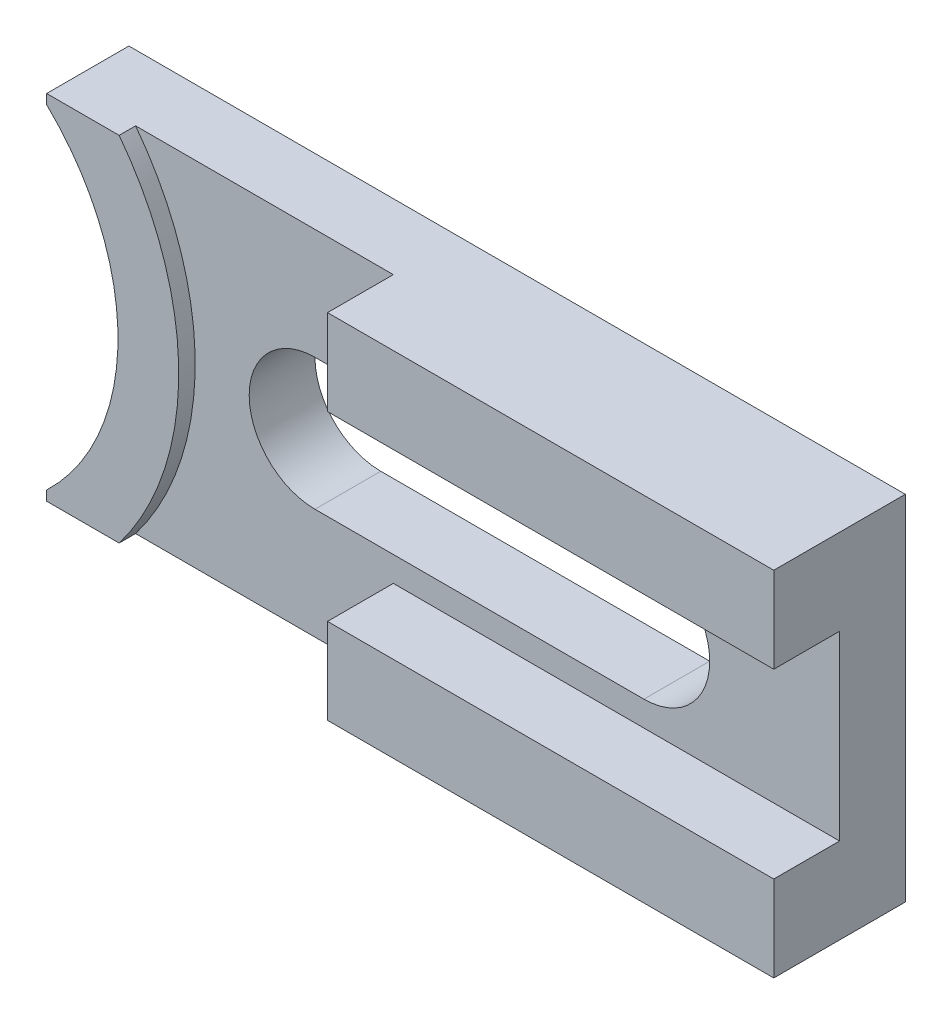
from build123d import *

# Parameters (mm, degrees)
SKETCH2_W                = 17.229179535
SKETCH2_H                = 3.310134884
BOSS_EXTRUDE1_DEPTH      = 2.54
BOSS_EXTRUDE1_2_DEPTH    = 2.54
BOSS_EXTRUDE2_DEPTH      = 2.54
BOSS_EXTRUDE3_DEPTH      = 0.635
BOSS_EXTRUDE3_DEPTH_BACK = 2.54
CUT_EXTRUDE2_DEPTH       = 38.115659497
CUT_EXTRUDE3_DEPTH       = 0.5


with BuildPart() as part:
    # Sketch2 → Boss-Extrude1 (new body)
    with BuildSketch(Plane.XY):
        with Locations((27.514228352, 5.16213735)):
            Rectangle(SKETCH2_W, SKETCH2_H)
    extrude(amount=BOSS_EXTRUDE1_DEPTH)



with BuildPart() as body_2:
    # Sketch2 → Boss-Extrude1 2 (new body)
    with BuildSketch(Plane.XY):
        with Locations((27.514228352, -5.16213735)):
            Rectangle(SKETCH2_W, SKETCH2_H)
    extrude(amount=BOSS_EXTRUDE1_2_DEPTH)


with BuildPart() as part_1:
    add(part.part)

    add(body_2.part)  # Boss-Extrude2 merges body 2
    # Sketch2<3> → Boss-Extrude2 (add)
    with BuildSketch(Plane.XY):
        with BuildLine():
            Line((36.128818119, 6.817204792), (8.949202134, 6.817204792))
            ThreePointArc((8.949202134, 6.817204792), (11.25, 0), (8.949202134, -6.817204792))
            Line((8.949202134, -6.817204792), (36.128818119, -6.817204792))
            Line((36.128818119, -6.817204792), (36.128818119, 6.817204792))
        make_face()
    extrude(amount=-BOSS_EXTRUDE2_DEPTH)

    # Sketch2<5> → Boss-Extrude3 (add, two sides: drawn at the far end of the back side and taken through both)
    with BuildSketch(Plane.XY.offset(-BOSS_EXTRUDE3_DEPTH_BACK)):
        with BuildLine():
            ThreePointArc((11.25, 0), (10.659292284, 3.597497463), (8.949202134, 6.817204792))
            Line((8.949202134, 6.817204792), (6.15087204, 6.817204792))
            Line((6.15087204, 6.817204792), (6.15087204, 6.439326944))
            ThreePointArc((6.15087204, 6.439326944), (8.187532429, 3.501781128), (8.904951339, 0))
            ThreePointArc((8.904951339, 0), (8.187532429, -3.501781128), (6.15087204, -6.439326944))
            Line((6.15087204, -6.439326944), (6.15087204, -6.817204792))
            Line((6.15087204, -6.817204792), (8.949202134, -6.817204792))
            ThreePointArc((8.949202134, -6.817204792), (10.659292284, -3.597497463), (11.25, 0))
        make_face()
    extrude(amount=BOSS_EXTRUDE3_DEPTH + BOSS_EXTRUDE3_DEPTH_BACK)

    # Sketch3 → Cut-Extrude2 (cut, through all)
    with BuildSketch(Plane(origin=(0, 0, -2.54), x_dir=(-1, 0, 0), z_dir=(0, 0, -1))):
        with BuildLine():
            Line((-28.575, 2.54), (-15.875, 2.54))
            ThreePointArc((-15.875, 2.54), (-13.335, 0), (-15.875, -2.54))
            Line((-15.875, -2.54), (-28.575, -2.54))
            ThreePointArc((-28.575, -2.54), (-31.115, 0), (-28.575, 2.54))
        make_face()
    extrude(amount=-CUT_EXTRUDE2_DEPTH, mode=Mode.SUBTRACT)

    # Sketch4 → Cut-Extrude3 (cut)
    # profile 1 of 5: a face of its own
    with BuildSketch(Plane(origin=(0, 0, -2.54), x_dir=(-1, 0, 0), z_dir=(0, 0, -1))):
        with BuildLine():
            Line((-33.225274444, 3.974358974), (-33.109088547, 3.756410256))
            add(Edge.make_bspline(
                [(-33.109088547, 3.756410256), (-33.135397759, 3.740527107), (-33.185681951, 3.710170009), (-33.253420727, 3.660322112), (-33.311184101, 3.610759802), (-33.358913749, 3.560993838), (-33.395842991, 3.510332935), (-33.422532526, 3.459294284), (-33.439307786, 3.407558443), (-33.441395009, 3.372578171), (-33.44242188, 3.35536859)],
                knots=[0, 0, 0, 0, 1.354943589, 2.589672558, 3.704607527, 4.708856974, 5.624398268, 6.459549776, 7.242129862, 8, 8, 8, 8], degree=3))
            add(Edge.make_bspline(
                [(-33.44242188, 3.35536859), (-33.441905488, 3.339302478), (-33.440882664, 3.307480132), (-33.432011039, 3.260724124), (-33.41849678, 3.215449059), (-33.399241833, 3.172453164), (-33.375690629, 3.132691911), (-33.347484885, 3.097656085), (-33.31601471, 3.067453928), (-33.280806652, 3.043011922), (-33.243529513, 3.023610821), (-33.204637166, 3.010092109), (-33.164605399, 3.001638382), (-33.137575532, 3.000550109), (-33.123912265, 3)],
                knots=[0, 0, 0, 0, 1.088566894, 2.156137864, 3.216115032, 4.286409646, 5.342511199, 6.341014339, 7.327494598, 8.289734136, 9.237503728, 10.168335026, 11.074115738, 12, 12, 12, 12], degree=3))
            add(Edge.make_bspline(
                [(-33.123912265, 3), (-33.108330276, 3.000736823), (-33.076808333, 3.002227397), (-33.030325685, 3.015739917), (-32.983768676, 3.035686613), (-32.954965866, 3.054921495), (-32.940018034, 3.064903846)],
                knots=[0, 0, 0, 0, 0.942144539, 1.905933023, 2.913239343, 4, 4, 4, 4], degree=3))
            add(Edge.make_bspline(
                [(-32.940018034, 3.064903846), (-32.929120466, 3.073486486), (-32.906180161, 3.091553671), (-32.871643174, 3.12213629), (-32.835615972, 3.157921969), (-32.798261088, 3.198852657), (-32.75874151, 3.244208916), (-32.718078641, 3.294761196), (-32.675585273, 3.350152128), (-32.647077398, 3.388968556), (-32.632325726, 3.409054487)],
                knots=[0, 0, 0, 0, 0.718593868, 1.512701116, 2.388487339, 3.348232282, 4.383172848, 5.504845107, 6.708858268, 8, 8, 8, 8], degree=3))
            add(Edge.make_bspline(
                [(-32.632325726, 3.409054487), (-32.617435689, 3.42953688), (-32.588865877, 3.468836855), (-32.546982401, 3.52420709), (-32.508363515, 3.573851894), (-32.472979034, 3.617390572), (-32.440521413, 3.654828072), (-32.41112384, 3.68608553), (-32.38559306, 3.712103925), (-32.368414754, 3.726085468), (-32.360691111, 3.732371795)],
                knots=[0, 0, 0, 0, 1.435833971, 2.754963323, 3.936484598, 5.002077172, 5.935979083, 6.744956812, 7.435712417, 8, 8, 8, 8], degree=3))
            add(Edge.make_bspline(
                [(-32.360691111, 3.732371795), (-32.348833292, 3.741548982), (-32.325537652, 3.759578305), (-32.288169937, 3.782404052), (-32.250313166, 3.802045096), (-32.211616809, 3.818222408), (-32.172204487, 3.83075885), (-32.131937984, 3.83938333), (-32.090977246, 3.845466888), (-32.063304366, 3.845924035), (-32.049393034, 3.846153846)],
                knots=[0, 0, 0, 0, 1.064105702, 2.090521257, 3.104283852, 4.09061442, 5.065433238, 6.036507983, 7.012940167, 8, 8, 8, 8], degree=3))
            add(Edge.make_bspline(
                [(-32.049393034, 3.846153846), (-32.027697321, 3.845432655), (-31.984741397, 3.844004748), (-31.922053473, 3.83116358), (-31.862182813, 3.810529215), (-31.805903248, 3.781653649), (-31.753779275, 3.745555142), (-31.706708212, 3.702931404), (-31.666391875, 3.652799642), (-31.632269691, 3.596970713), (-31.604624254, 3.536757845), (-31.584912972, 3.473349155), (-31.572964926, 3.407501727), (-31.571412089, 3.362763111), (-31.570627008, 3.340144231)],
                knots=[0, 0, 0, 0, 1.004646316, 1.989126202, 2.95222254, 3.932177672, 4.910861341, 5.883497635, 6.864703059, 7.88170562, 8.909314152, 9.927333358, 10.952104425, 12, 12, 12, 12], degree=3))
            add(Edge.make_bspline(
                [(-31.570627008, 3.340144231), (-31.571546277, 3.314461743), (-31.573366893, 3.263597453), (-31.585704912, 3.188618707), (-31.607918669, 3.116920605), (-31.63243853, 3.059175696), (-31.657508158, 3.014318465), (-31.680150325, 2.980392023), (-31.70577481, 2.945619171), (-31.735658977, 2.911101266), (-31.768356916, 2.875492989), (-31.805646013, 2.840617769), (-31.845389183, 2.804268538), (-31.874050949, 2.781100869), (-31.888735983, 2.769230769)],
                knots=[0, 0, 0, 0, 1.360590218, 2.69465552, 4.010645498, 5.328858611, 6.009843139, 6.729980544, 7.488405022, 8.296451933, 9.147430815, 10.048128915, 10.999946711, 12, 12, 12, 12], degree=3))
            Line((-31.888735983, 2.769230769), (-32.03216547, 2.978365385))
            add(Edge.make_bspline(
                [(-32.03216547, 2.978365385), (-32.020488735, 2.98925556), (-31.997968907, 3.010258425), (-31.966438434, 3.041513461), (-31.937940019, 3.070722889), (-31.912582309, 3.098006964), (-31.890372468, 3.123445151), (-31.872107523, 3.147719243), (-31.856228601, 3.1694388), (-31.840192493, 3.196305686), (-31.824692394, 3.229698776), (-31.810834516, 3.270728438), (-31.803164213, 3.31368597), (-31.8019919, 3.342653293), (-31.801396239, 3.357371795)],
                knots=[0, 0, 0, 0, 1.253529984, 2.417566204, 3.48529857, 4.457251953, 5.342048711, 6.134767478, 6.841715926, 7.453097701, 8.588204789, 9.725488963, 10.844304836, 12, 12, 12, 12], degree=3))
            add(Edge.make_bspline(
                [(-31.801396239, 3.357371795), (-31.802135672, 3.373077214), (-31.80357319, 3.40360983), (-31.815686386, 3.447389717), (-31.835166713, 3.48749697), (-31.862468917, 3.522968257), (-31.895988887, 3.552981815), (-31.935716487, 3.574613877), (-31.980786875, 3.587331178), (-32.012449343, 3.588916758), (-32.028960342, 3.58974359)],
                knots=[0, 0, 0, 0, 1.033786987, 2.00976631, 2.970458119, 3.95651055, 4.942051941, 5.915168215, 6.91282465, 8, 8, 8, 8], degree=3))
            add(Edge.make_bspline(
                [(-32.028960342, 3.58974359), (-32.03965885, 3.58942336), (-32.061029991, 3.588783674), (-32.092668871, 3.584005319), (-32.123356134, 3.575384368), (-32.153347795, 3.563690371), (-32.182882348, 3.548225717), (-32.212141134, 3.528912744), (-32.241305506, 3.505347308), (-32.259743791, 3.487340981), (-32.269344957, 3.477964744)],
                knots=[0, 0, 0, 0, 0.941102048, 1.879927795, 2.806320176, 3.740133313, 4.70706341, 5.733547381, 6.819814909, 8, 8, 8, 8], degree=3))
            add(Edge.make_bspline(
                [(-32.269344957, 3.477964744), (-32.273815768, 3.473212358), (-32.284077215, 3.462304636), (-32.299790535, 3.442298702), (-32.31949084, 3.41792459), (-32.342856588, 3.388844388), (-32.368619216, 3.354101873), (-32.398499881, 3.314981599), (-32.431153388, 3.270493038), (-32.454045712, 3.239186312), (-32.466059701, 3.22275641)],
                knots=[0, 0, 0, 0, 0.485581606, 1.114511607, 1.892484918, 2.819534315, 3.891398566, 5.11240712, 6.484579029, 8, 8, 8, 8], degree=3))
            add(Edge.make_bspline(
                [(-32.466059701, 3.22275641), (-32.482372316, 3.200369856), (-32.513929639, 3.157062286), (-32.561578069, 3.095585672), (-32.608045925, 3.040063654), (-32.652594577, 2.98963407), (-32.695544662, 2.944741214), (-32.737485444, 2.905805437), (-32.777211256, 2.871839413), (-32.827911947, 2.835632106), (-32.890268363, 2.799209173), (-32.966069366, 2.767599157), (-33.041948917, 2.747479866), (-33.092813451, 2.744874737), (-33.117902649, 2.743589744)],
                knots=[0, 0, 0, 0, 1.186639563, 2.29559556, 3.331401308, 4.287832086, 5.178002532, 5.991653193, 6.738845359, 7.415240842, 8.658551622, 9.823054859, 10.926210341, 12, 12, 12, 12], degree=3))
            add(Edge.make_bspline(
                [(-33.117902649, 2.743589744), (-33.135693273, 2.744157439), (-33.171053496, 2.745285778), (-33.223335851, 2.753466546), (-33.274152506, 2.767078623), (-33.32328888, 2.786662062), (-33.371206131, 2.811088375), (-33.417485336, 2.84137537), (-33.461948163, 2.877424327), (-33.504863285, 2.917714399), (-33.544303955, 2.962265046), (-33.579016946, 3.010040558), (-33.608015986, 3.060895071), (-33.631543673, 3.114436707), (-33.650715816, 3.170351308), (-33.66384713, 3.229191439), (-33.671426719, 3.290666084), (-33.672596783, 3.332511073), (-33.673191111, 3.353766026)],
                knots=[0, 0, 0, 0, 0.932646097, 1.853705421, 2.767602683, 3.685675702, 4.622099834, 5.5835355, 6.579838097, 7.620108014, 8.666886363, 9.695041649, 10.711275682, 11.730160242, 12.757671447, 13.80585424, 14.885494678, 16, 16, 16, 16], degree=3))
            add(Edge.make_bspline(
                [(-33.673191111, 3.353766026), (-33.672846851, 3.369265378), (-33.6721688, 3.399792694), (-33.667867804, 3.445112863), (-33.659601332, 3.489215033), (-33.648913617, 3.532341002), (-33.635304255, 3.574517684), (-33.617895385, 3.615201539), (-33.597898893, 3.655070047), (-33.574485072, 3.693894504), (-33.547069331, 3.731724419), (-33.515245048, 3.768774773), (-33.478452791, 3.80483035), (-33.43717057, 3.840509219), (-33.390934044, 3.875340016), (-33.339986341, 3.909241424), (-33.284491752, 3.942646303), (-33.245402609, 3.963579729), (-33.225274444, 3.974358974)],
                knots=[0, 0, 0, 0, 0.916943493, 1.805999526, 2.689245248, 3.568702553, 4.433092864, 5.307568578, 6.183755457, 7.069823058, 7.986358083, 8.944343836, 9.955449961, 11.030835633, 12.170024038, 13.377301724, 14.649494474, 16, 16, 16, 16], degree=3))
        make_face()
    # profile 2 of 5: a face of its own
    with BuildSketch(Plane(origin=(0, 0, -2.54), x_dir=(-1, 0, 0), z_dir=(0, 0, -1))):
        Polygon((-33.62190906, 2.358974359), (-31.62190906, 2.358974359), (-31.62190906, 2.264022436), (-33.14154047, 1.051282051), (-31.62190906, 1.051282051), (-31.62190906, 0.794871795), (-33.62190906, 0.794871795), (-33.62190906, 0.899839744), (-32.10628406, 2.102564103), (-33.62190906, 2.102564103), align=None)
    # profile 3 of 5: a face of its own
    with BuildSketch(Plane(origin=(0, 0, -2.54), x_dir=(-1, 0, 0), z_dir=(0, 0, -1))):
        Polygon((-31.62190906, 0.024839744), (-31.62190906, -0.41025641), (-33.62190906, -0.41025641), (-33.62190906, -0.153846154), (-31.852678291, -0.153846154), (-31.852678291, 0.153846154), align=None)
    # profile 4 of 5: a face of its own
    with BuildSketch(Plane(origin=(0, 0, -2.54), x_dir=(-1, 0, 0), z_dir=(0, 0, -1))):
        with BuildLine():
            add(Edge.make_bspline(
                [(-32.622710342, -1.102564103), (-32.590922144, -1.102754636), (-32.529188222, -1.10312466), (-32.439382424, -1.107124153), (-32.355081649, -1.113998326), (-32.276303771, -1.122906935), (-32.20289796, -1.134963676), (-32.135089721, -1.149637558), (-32.072525005, -1.166749586), (-32.015289517, -1.186877957), (-31.962507266, -1.209657944), (-31.912831753, -1.233847135), (-31.866841779, -1.261434938), (-31.823559706, -1.290274407), (-31.783800334, -1.321948203), (-31.747504573, -1.355966577), (-31.713950657, -1.392094895), (-31.684111533, -1.430632439), (-31.657103935, -1.470455982), (-31.634329802, -1.512080678), (-31.6146127, -1.554448226), (-31.598392426, -1.598082245), (-31.586031877, -1.642876489), (-31.577314026, -1.688978808), (-31.57132718, -1.736087139), (-31.570861205, -1.768010181), (-31.570627008, -1.784054487)],
                knots=[0, 0, 0, 0, 1.622811576, 3.151563441, 4.588026035, 5.94029406, 7.197913742, 8.384107618, 9.480809094, 10.507228659, 11.478571551, 12.414650154, 13.325535228, 14.2143099, 15.068275608, 15.917273341, 16.751997476, 17.582590393, 18.403274167, 19.205888516, 20.00207731, 20.787301911, 21.579627962, 22.371220309, 23.181386264, 24, 24, 24, 24], degree=3))
            add(Edge.make_bspline(
                [(-31.570627008, -1.784054487), (-31.571087893, -1.801557218), (-31.571997599, -1.8361045), (-31.576949044, -1.88737403), (-31.586950059, -1.936925791), (-31.599499868, -1.985434085), (-31.616624868, -2.032133717), (-31.63647422, -2.077980154), (-31.661206349, -2.121730943), (-31.688700644, -2.164405092), (-31.719997495, -2.204821536), (-31.754701762, -2.242968035), (-31.792204769, -2.279150289), (-31.833553405, -2.312482206), (-31.877831241, -2.343799185), (-31.925893517, -2.372119433), (-31.9767688, -2.398636863), (-32.03111905, -2.422869619), (-32.089495781, -2.444094066), (-32.152139351, -2.462453119), (-32.219292339, -2.478050977), (-32.291114884, -2.490785159), (-32.36759461, -2.500657224), (-32.448577853, -2.507931464), (-32.534132185, -2.511733071), (-32.592658989, -2.512451583), (-32.622710342, -2.512820513)],
                knots=[0, 0, 0, 0, 0.874955972, 1.727007683, 2.569966518, 3.39885729, 4.22852693, 5.05324231, 5.892732763, 6.736879738, 7.588591564, 8.443852423, 9.31242121, 10.190096693, 11.095551351, 12.020402901, 12.975652316, 13.961650062, 14.992029691, 16.077525255, 17.222105665, 18.435726601, 19.721371012, 21.074900095, 22.498069168, 24, 24, 24, 24], degree=3))
            add(Edge.make_bspline(
                [(-32.622710342, -2.512820513), (-32.652627544, -2.512447169), (-32.710886205, -2.511720146), (-32.796048882, -2.507980606), (-32.876584819, -2.500491224), (-32.952751382, -2.491372065), (-33.024179934, -2.478221915), (-33.09134588, -2.463409511), (-33.153726283, -2.44484146), (-33.211893955, -2.424090456), (-33.266012032, -2.400181439), (-33.316666456, -2.373844648), (-33.364248666, -2.34532986), (-33.408649247, -2.314368486), (-33.449683868, -2.280671711), (-33.488220371, -2.245143902), (-33.522431323, -2.206274861), (-33.554410318, -2.165975492), (-33.58228714, -2.123243543), (-33.606202934, -2.078835742), (-33.627685609, -2.033563695), (-33.643467909, -1.98613853), (-33.657291868, -1.937756463), (-33.666126591, -1.887672577), (-33.671996031, -1.836277056), (-33.672790375, -1.801565846), (-33.673191111, -1.784054487)],
                knots=[0, 0, 0, 0, 1.496455906, 2.914093261, 4.26205393, 5.541251588, 6.749270319, 7.893267397, 8.979632811, 10.002279172, 10.980256255, 11.936271148, 12.856134035, 13.753010222, 14.640786415, 15.510307815, 16.371217582, 17.227710933, 18.08177858, 18.918722772, 19.749594414, 20.584002608, 21.415303724, 22.264262717, 23.124342892, 24, 24, 24, 24], degree=3))
            add(Edge.make_bspline(
                [(-33.673191111, -1.784054487), (-33.672916399, -1.767881413), (-33.672372312, -1.735849485), (-33.667032732, -1.688549989), (-33.658178614, -1.642470433), (-33.645741951, -1.597760632), (-33.630091668, -1.554167202), (-33.610783216, -1.511956772), (-33.587788088, -1.471101903), (-33.561781809, -1.431310437), (-33.532259238, -1.393175157), (-33.498701429, -1.357715909), (-33.462531633, -1.323543771), (-33.422468615, -1.292283749), (-33.379412213, -1.262685797), (-33.332730635, -1.236033479), (-33.282960638, -1.211190293), (-33.229726841, -1.18810053), (-33.171992907, -1.167480143), (-33.109021907, -1.150076324), (-33.040796248, -1.13529201), (-32.967338659, -1.123511862), (-32.888773644, -1.113830502), (-32.804830833, -1.107172546), (-32.715566453, -1.10311688), (-32.654231992, -1.102751753), (-32.622710342, -1.102564103)],
                knots=[0, 0, 0, 0, 0.826175227, 1.636298951, 2.428607917, 3.22165125, 4.005242705, 4.793101538, 5.590478474, 6.398674186, 7.220441003, 8.050917132, 8.891038291, 9.760711332, 10.644645088, 11.558803281, 12.504879914, 13.486065991, 14.522126426, 15.634800469, 16.822068191, 18.087560174, 19.435086877, 20.866048074, 22.389366553, 24, 24, 24, 24], degree=3))
        make_face()
        with BuildLine():
            add(Edge.make_bspline(
                [(-32.62190906, -1.358974359), (-32.648753713, -1.359096986), (-32.700722953, -1.359334384), (-32.775957141, -1.362030494), (-32.845914981, -1.367147359), (-32.910824168, -1.372579691), (-32.970510532, -1.381249968), (-33.025142895, -1.390957901), (-33.074486208, -1.402978522), (-33.119027226, -1.416663756), (-33.159543616, -1.432014058), (-33.19684568, -1.44904367), (-33.231804824, -1.466693317), (-33.26352626, -1.4866894), (-33.293007469, -1.507308453), (-33.319533375, -1.529992063), (-33.343623116, -1.553772929), (-33.370827689, -1.587118986), (-33.398912526, -1.62986046), (-33.423650256, -1.682702786), (-33.439719348, -1.736112043), (-33.441526811, -1.772195366), (-33.44242188, -1.790064103)],
                knots=[0, 0, 0, 0, 1.5649567, 3.029639083, 4.387528411, 5.654169398, 6.825669047, 7.902233587, 8.887918217, 9.784295864, 10.617159105, 11.411620328, 12.174198952, 12.897954492, 13.595742744, 14.269624431, 14.930243367, 15.566226112, 16.775482614, 17.900530002, 18.960326499, 20, 20, 20, 20], degree=3))
            add(Edge.make_bspline(
                [(-33.44242188, -1.790064103), (-33.441380519, -1.810320907), (-33.439310936, -1.850578921), (-33.42369605, -1.909962136), (-33.39817658, -1.967097796), (-33.368872352, -2.012350216), (-33.340512219, -2.046488109), (-33.316358971, -2.071138128), (-33.289396363, -2.093859347), (-33.260031667, -2.115308636), (-33.227785443, -2.134703183), (-33.193389301, -2.153403967), (-33.156018098, -2.169686565), (-33.129976157, -2.179097041), (-33.116700726, -2.183894231)],
                knots=[0, 0, 0, 0, 1.331941515, 2.647076996, 4.012321115, 5.435916507, 6.178566488, 6.930518042, 7.703588399, 8.496388142, 9.320850189, 10.177968117, 11.071180671, 12, 12, 12, 12], degree=3))
            add(Edge.make_bspline(
                [(-33.116700726, -2.183894231), (-33.099258695, -2.189673738), (-33.063701906, -2.201455663), (-33.008342342, -2.216216795), (-32.95025352, -2.228437196), (-32.889744796, -2.238959642), (-32.826511328, -2.246949351), (-32.760614024, -2.252471918), (-32.69205248, -2.255639742), (-32.645550098, -2.256150563), (-32.62190906, -2.256410256)],
                knots=[0, 0, 0, 0, 0.877617242, 1.789083553, 2.735016418, 3.71249782, 4.722174671, 5.778575778, 6.870664861, 8, 8, 8, 8], degree=3))
            add(Edge.make_bspline(
                [(-32.62190906, -2.256410256), (-32.5982657, -2.256347655), (-32.55215719, -2.256225571), (-32.484710069, -2.252629152), (-32.420515563, -2.248250319), (-32.3597566, -2.240809709), (-32.302252989, -2.23213963), (-32.248018558, -2.221508246), (-32.197307572, -2.208136571), (-32.149702474, -2.1935282), (-32.105654069, -2.176374515), (-32.064325663, -2.158771307), (-32.026542679, -2.138799345), (-31.991511116, -2.11818394), (-31.959721164, -2.095701962), (-31.931255182, -2.071623249), (-31.905839875, -2.046362592), (-31.876730821, -2.011329935), (-31.847340774, -1.965407156), (-31.820358056, -1.908410182), (-31.804600155, -1.849529305), (-31.802458637, -1.809782376), (-31.801396239, -1.790064103)],
                knots=[0, 0, 0, 0, 1.352995991, 2.638568693, 3.864972623, 5.034911379, 6.140799663, 7.193115141, 8.196082668, 9.141322174, 10.041316549, 10.90046054, 11.710713657, 12.485432581, 13.225595763, 13.936117752, 14.617123955, 15.273802947, 16.539521554, 17.726268428, 18.872011902, 20, 20, 20, 20], degree=3))
            add(Edge.make_bspline(
                [(-31.801396239, -1.790064103), (-31.802304042, -1.772198267), (-31.804143762, -1.735992014), (-31.820096686, -1.682420017), (-31.844800411, -1.629522362), (-31.873079451, -1.58703634), (-31.900092358, -1.553946193), (-31.923857406, -1.530190634), (-31.950676687, -1.508377535), (-31.979282114, -1.486641351), (-32.011771161, -1.467961148), (-32.046165665, -1.449059931), (-32.083827047, -1.432588629), (-32.124371942, -1.417034392), (-32.168930632, -1.403352502), (-32.218325602, -1.391515315), (-32.272814909, -1.38093899), (-32.332667267, -1.373316241), (-32.397597717, -1.366908443), (-32.467735839, -1.362112856), (-32.543092931, -1.359312827), (-32.595063645, -1.359089644), (-32.62190906, -1.358974359)],
                knots=[0, 0, 0, 0, 1.039749656, 2.107118784, 3.232248581, 4.435084528, 5.071113858, 5.720770062, 6.389690065, 7.08578983, 7.812190141, 8.571558508, 9.373180297, 10.206104544, 11.102547849, 12.08830468, 13.166382946, 14.336907176, 15.604382513, 16.970138999, 18.434928669, 20, 20, 20, 20], degree=3))
        make_face(mode=Mode.SUBTRACT)
    # profile 5 of 5: a face of its own
    with BuildSketch(Plane(origin=(0, 0, -2.54), x_dir=(-1, 0, 0), z_dir=(0, 0, -1))):
        Polygon((-31.570627008, -3.744791667), (-31.570627008, -3.846153846), (-32.929601367, -3.846153846), (-32.929601367, -4.076923077), (-33.160370598, -4.076923077), (-33.160370598, -3.846153846), (-33.62190906, -3.846153846), (-33.62190906, -3.58974359), (-33.160370598, -3.58974359), (-33.160370598, -2.666666667), align=None)
        Polygon((-32.929601367, -3.58974359), (-32.134328932, -3.58974359), (-32.929601367, -3.080528846), align=None, mode=Mode.SUBTRACT)
    extrude(amount=-CUT_EXTRUDE3_DEPTH, mode=Mode.SUBTRACT)


solid = part_1.part
